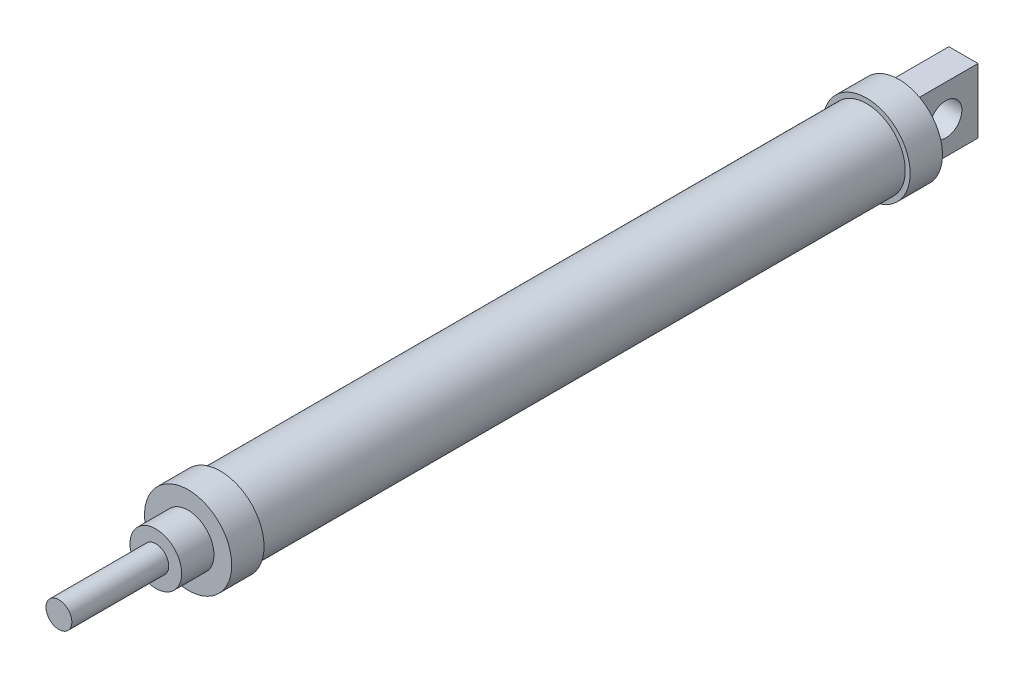
from build123d import *

# Parameters (mm, degrees)
SKETCH1_R           = 13.5
BOSS_EXTRUDE1_DEPTH = 10
SKETCH2_R           = 8
BOSS_EXTRUDE2_DEPTH = 10
SKETCH3_R           = 12
BOSS_EXTRUDE3_DEPTH = 200
BOSS_EXTRUDE4_START = 10
SKETCH4_R           = 13.5
BOSS_EXTRUDE4_DEPTH = 10
SKETCH5_W           = 9
SKETCH5_H           = 20
BOSS_EXTRUDE5_DEPTH = 20
SKETCH6_R           = 5
CUT_EXTRUDE1_DEPTH  = 20
SKETCH8_R           = 4
BOSS_EXTRUDE6_DEPTH = 30


with BuildPart() as part:
    # Sketch1 → Boss-Extrude1 (new body)
    with BuildSketch(Plane.XY):
        Circle(SKETCH1_R)
    extrude(amount=BOSS_EXTRUDE1_DEPTH)

    # Sketch2 → Boss-Extrude2 (add)
    with BuildSketch(Plane.XY.offset(10)):
        Circle(SKETCH2_R)
    extrude(amount=BOSS_EXTRUDE2_DEPTH)

    # Sketch3 → Boss-Extrude3 (add)
    with BuildSketch(Plane(origin=(0, 0, 0), x_dir=(-1, 0, 0), z_dir=(0, 0, -1))):
        Circle(SKETCH3_R)
    extrude(amount=BOSS_EXTRUDE3_DEPTH)

    # Sketch4 → Boss-Extrude4 (add)
    with BuildSketch(Plane(origin=(0, 0, -200), x_dir=(-1, 0, 0), z_dir=(0, 0, -1)).offset(BOSS_EXTRUDE4_START)):
        with Locations(Location((0, 0, 0), (0, 0, 180))):
            Circle(SKETCH4_R)
    extrude(amount=-BOSS_EXTRUDE4_DEPTH)

    # Sketch5 → Boss-Extrude5 (add)
    with BuildSketch(Plane(origin=(0, 0, -210), x_dir=(-1, 0, 0), z_dir=(0, 0, -1))):
        Rectangle(SKETCH5_W, SKETCH5_H)
    extrude(amount=BOSS_EXTRUDE5_DEPTH)

    # Sketch6 → Cut-Extrude1 (cut)
    with BuildSketch(Plane(origin=(4.5, 0, 0), x_dir=(0, 0, -1), z_dir=(1, 0, 0))):
        with Locations(Location((220, 0, 0), (0, 0, 90))):
            Circle(SKETCH6_R)
    extrude(amount=-CUT_EXTRUDE1_DEPTH, mode=Mode.SUBTRACT)

    # Sketch8 → Boss-Extrude6 (add)
    with BuildSketch(Plane.XY.offset(20)):
        Circle(SKETCH8_R)
    extrude(amount=BOSS_EXTRUDE6_DEPTH)


solid = part.part
